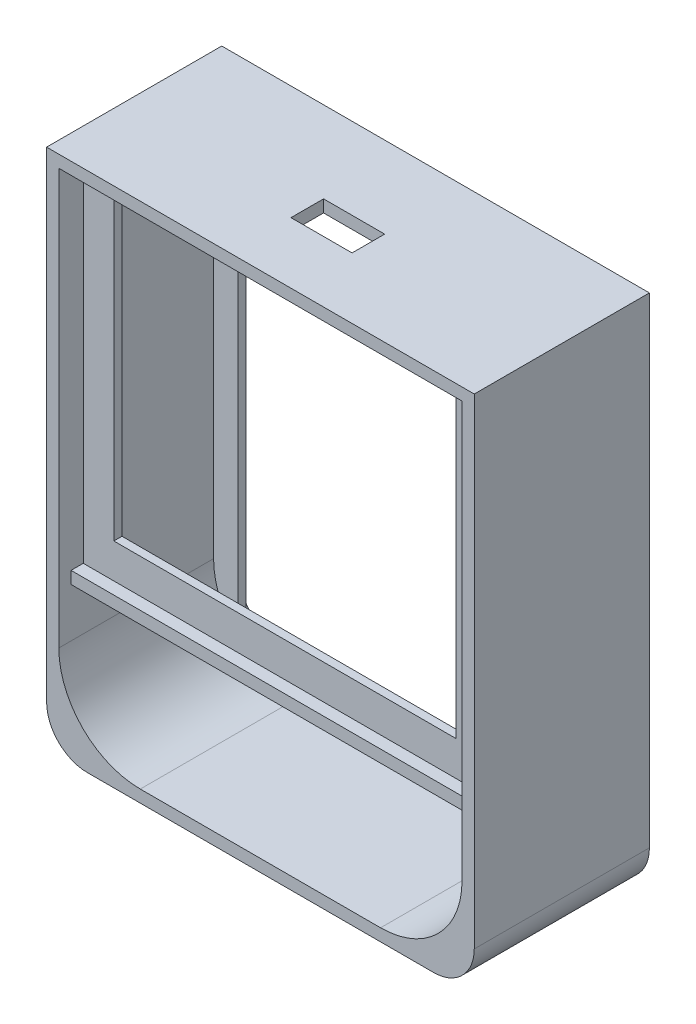
from build123d import *

# Parameters (mm, degrees)
SKETCH_1_W          = 105
SKETCH_1_H          = 128
EXTRUDE_1_DEPTH     = 43
SKETCH_2_W          = 99
SKETCH_2_H          = 122
CUT_EXTRUDE_1_DEPTH = 50
SKETCH_3_W          = 99
SKETCH_3_H          = 2
EXTRUDE_2_DEPTH     = 90
CUT_EXTRUDE_2_REACH = 92.671
SKETCH_4_W          = 84
SKETCH_4_H          = 70
SKETCH_5_W          = 99
SKETCH_5_H          = 3
EXTRUDE_3_DEPTH     = 3
SKETCH_6_W          = 15
SKETCH_6_H          = 8
CUT_EXTRUDE_3_DEPTH = 10
SKETCH_8_W          = 84
SKETCH_8_H          = 8.5
CUT_EXTRUDE_4_DEPTH = 2
EXTRUDE_4_REACH     = 129.863
SKETCH_9_W          = 2
SKETCH_9_H          = 122
SKETCH_10_W         = 87
SKETCH_10_H         = 110
CUT_EXTRUDE_5_DEPTH = 8
FILLET_10_R         = 10
FILLET_11_R         = 20
FILLET_12_R         = 20
FILLET_13_R         = 10
FILLET_14_R         = 20
FILLET_15_R         = 20
FILLET_16_R         = 20


with BuildPart() as part:
    # 草图1 → 凸台-拉伸1 (new body)
    with BuildSketch(Plane.XY):
        Rectangle(SKETCH_1_W, SKETCH_1_H)
    extrude(amount=EXTRUDE_1_DEPTH)

    # 草图2 → 切除-拉伸1 (cut)
    with BuildSketch(Plane.XY.offset(43)):
        Rectangle(SKETCH_2_W, SKETCH_2_H)
    extrude(amount=-CUT_EXTRUDE_1_DEPTH, mode=Mode.SUBTRACT)

    # 草图3 → 凸台-拉伸2 (add)
    with BuildSketch(Plane.XZ.offset(-61)):
        with Locations((0, 36)):
            Rectangle(SKETCH_3_W, SKETCH_3_H)
    extrude(amount=EXTRUDE_2_DEPTH)

    # 草图4 → 切除-拉伸2 (cut, up to next)
    with BuildSketch(Plane.XY.offset(37), mode=Mode.PRIVATE) as cut_extrude_2_sk1:
        with Locations((0, 17.5)):
            Rectangle(SKETCH_4_W, SKETCH_4_H)
    cut_extrude_2_tool1 = extrude(cut_extrude_2_sk1.sketch, amount=-CUT_EXTRUDE_2_REACH, mode=Mode.PRIVATE) & part.part
    add(cut_extrude_2_tool1.solids().sort_by_distance((0, 17.5, 37))[0], mode=Mode.SUBTRACT)

    # 草图5 → 凸台-拉伸3 (add)
    with BuildSketch(Plane.XY.offset(37)):
        with Locations((0, -27.5)):
            Rectangle(SKETCH_5_W, SKETCH_5_H)
    extrude(amount=EXTRUDE_3_DEPTH)

    # 草图6 → 切除-拉伸3 (cut)
    with BuildSketch(Plane(origin=(0, 64, 0), x_dir=(1, 0, 0), z_dir=(0, 1, 0))):
        with Locations((0, -24)):
            Rectangle(SKETCH_6_W, SKETCH_6_H)
    extrude(amount=-CUT_EXTRUDE_3_DEPTH, mode=Mode.SUBTRACT)

    # 草图8 → 切除-拉伸4 (cut)
    with BuildSketch(Plane.XY.offset(37)):
        with Locations((0, 56.75)):
            Rectangle(SKETCH_8_W, SKETCH_8_H)
    extrude(amount=-CUT_EXTRUDE_4_DEPTH, mode=Mode.SUBTRACT)

    # 草图9 → 凸台-拉伸4 (add, up to next)
    with BuildSketch(Plane.ZY.offset(-49.5), mode=Mode.PRIVATE) as extrude_4_sk1:
        with Locations((4, 0)):
            Rectangle(SKETCH_9_W, SKETCH_9_H)
    extrude_4_tool1 = extrude(extrude_4_sk1.sketch, amount=EXTRUDE_4_REACH, mode=Mode.PRIVATE) - part.part
    add(extrude_4_tool1.solids().sort_by_distance((49.5, 0, 4))[0])

    # 草图10 → 切除-拉伸5 (cut)
    with BuildSketch(Plane(origin=(0, 0, 3), x_dir=(-1, 0, 0), z_dir=(0, 0, -1))):
        Rectangle(SKETCH_10_W, SKETCH_10_H)
    extrude(amount=-CUT_EXTRUDE_5_DEPTH, mode=Mode.SUBTRACT)

    # 圆角10
    fillet_10_edges = [part.edges().sort_by_distance(p)[0] for p in [
        (-52.5, -64, 21.5),
    ]]
    fillet(fillet_10_edges, radius=FILLET_10_R)

    # 圆角11
    fillet_11_edges = [part.edges().sort_by_distance(p)[0] for p in [
        (-49.5, -61, 1.5),
    ]]
    fillet(fillet_11_edges, radius=FILLET_11_R)

    # 圆角12
    fillet_12_edges = [part.edges().sort_by_distance(p)[0] for p in [
        (49.5, -61, 1.5),
    ]]
    fillet(fillet_12_edges, radius=FILLET_12_R)

    # 圆角13
    fillet_13_edges = [part.edges().sort_by_distance(p)[0] for p in [
        (52.5, -64, 21.5),
    ]]
    fillet(fillet_13_edges, radius=FILLET_13_R)

    # 圆角14
    fillet_14_edges = [part.edges().sort_by_distance(p)[0] for p in [
        (-49.5, 61, 1.5),
        (49.5, 61, 1.5),
    ]]
    fillet(fillet_14_edges, radius=FILLET_14_R)

    # 圆角15
    fillet_15_edges = [part.edges().sort_by_distance(p)[0] for p in [
        (49.5, -61, 24),
    ]]
    fillet(fillet_15_edges, radius=FILLET_15_R)

    # 圆角16
    fillet_16_edges = [part.edges().sort_by_distance(p)[0] for p in [
        (-49.5, -61, 24),
    ]]
    fillet(fillet_16_edges, radius=FILLET_16_R)


solid = part.part
